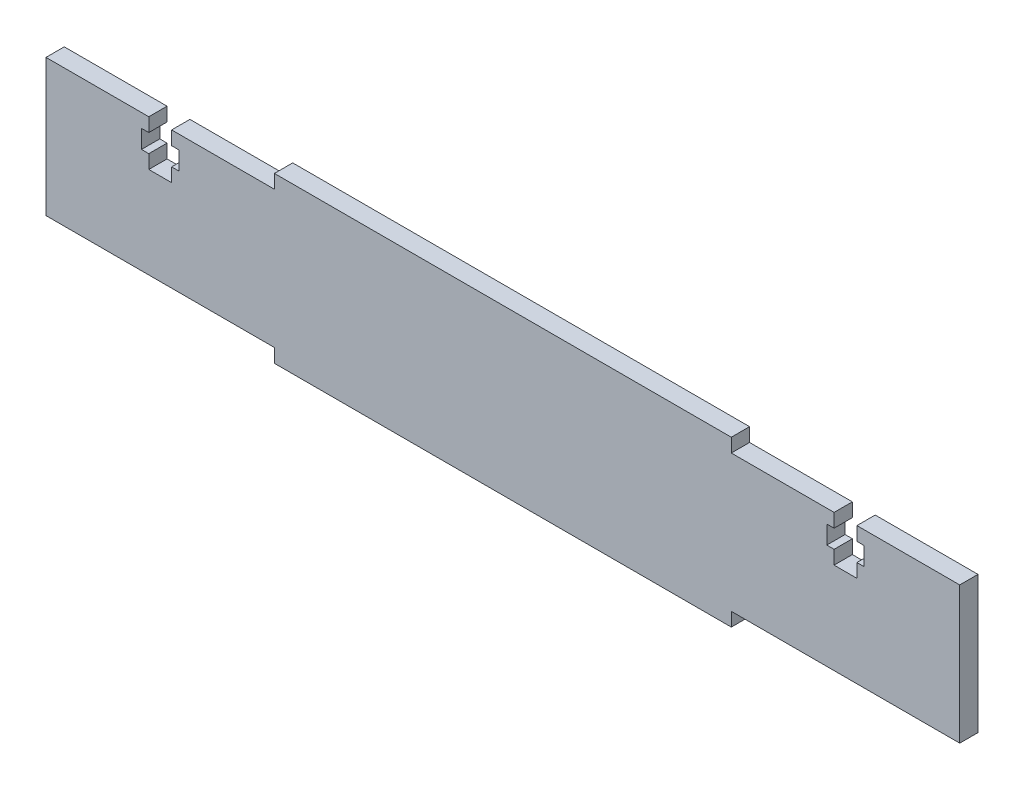
from build123d import *

# Parameters (mm, degrees)
SKETCH1_W           = 200
SKETCH1_H           = 30
SKETCH1_W_2         = 100
SKETCH1_H_2         = 6
BOSS_EXTRUDE1_DEPTH = 4
SKETCH2_W           = 5
SKETCH2_H           = 20
SKETCH2_W_2         = 8.2
SKETCH2_H_2         = 4
CUT_EXTRUDE1_DEPTH  = 10


with BuildPart() as part:
    # Sketch1 → Boss-Extrude1 (new body)
    with BuildSketch(Plane.XY):
        Rectangle(SKETCH1_W, SKETCH1_H)
        with Locations((0, -15)):
            Rectangle(SKETCH1_W_2, SKETCH1_H_2)
        with Locations((0, 15)):
            Rectangle(SKETCH1_W_2, SKETCH1_H_2)
    extrude(amount=BOSS_EXTRUDE1_DEPTH)

    # Sketch2 → Cut-Extrude1 (cut)
    with BuildSketch(Plane.XY.offset(4)):
        with Locations((-75, 15)):
            Rectangle(SKETCH2_W, SKETCH2_H)
        with Locations((-75, 10)):
            Rectangle(SKETCH2_W_2, SKETCH2_H_2)
    cut_extrude1 = extrude(amount=-CUT_EXTRUDE1_DEPTH, mode=Mode.SUBTRACT)

    # Mirror1: Cut-Extrude1 across plane
    add(cut_extrude1.mirror(Plane(origin=(0, 0, 0), x_dir=(0, 0, 1), z_dir=(1, 0, 0))), mode=Mode.SUBTRACT)


solid = part.part
